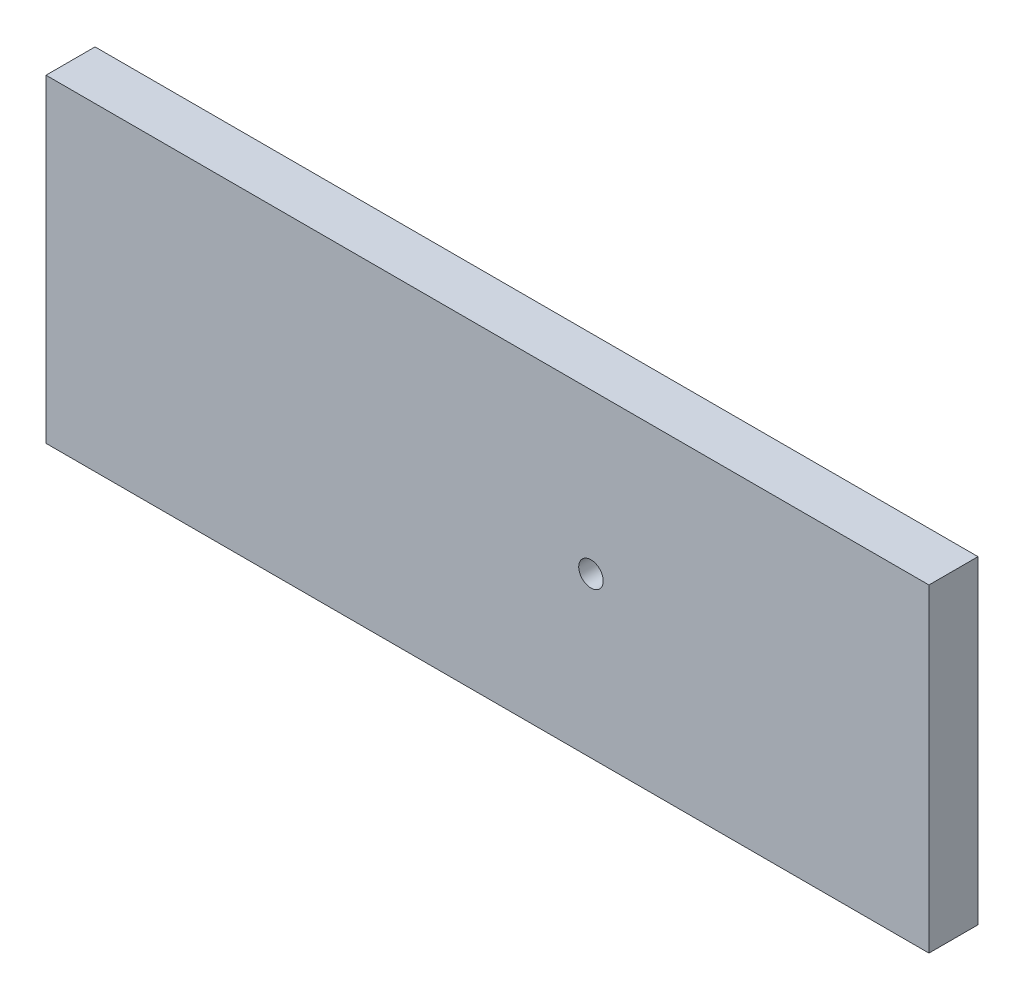
from build123d import *

# Parameters (mm, degrees)
ESQUISSE1_W        = 228.6
ESQUISSE1_H        = 82.55
ESQUISSE1_R        = 3.175
BOSS_EXTRU_1_DEPTH = 12.7


with BuildPart() as part:
    # Esquisse1 → Boss.-Extru.1 (new body)
    with BuildSketch(Plane.XY):
        Rectangle(ESQUISSE1_W, ESQUISSE1_H)
        with Locations((26.800000015, 0)):
            Circle(ESQUISSE1_R, mode=Mode.SUBTRACT)
    extrude(amount=BOSS_EXTRU_1_DEPTH)


solid = part.part
